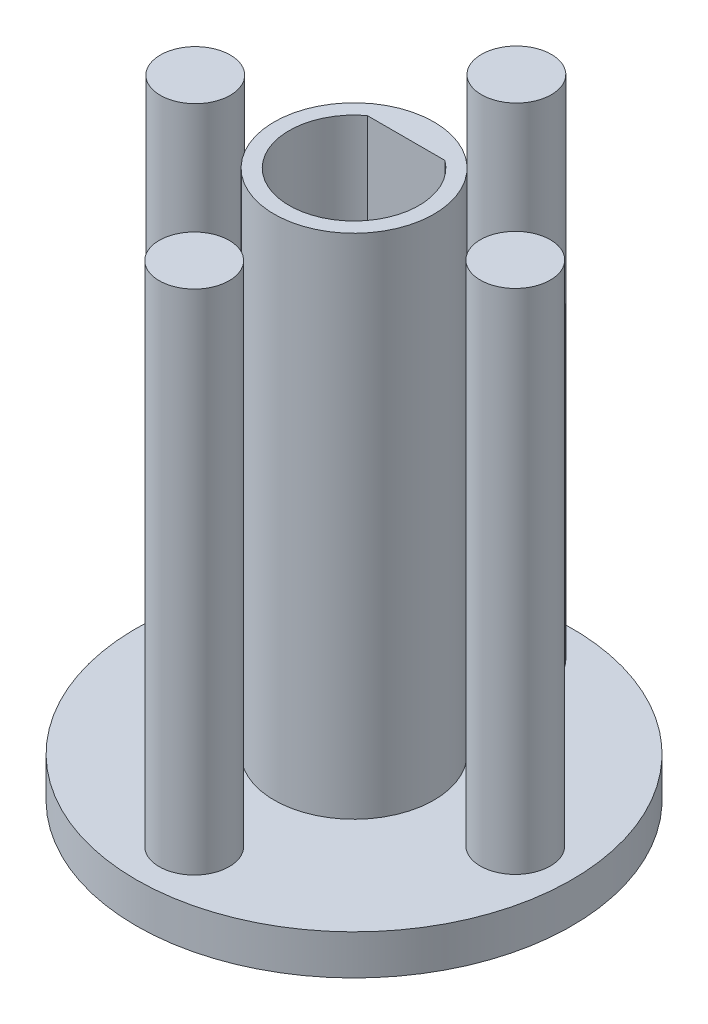
from build123d import *

# Parameters (mm, degrees)
SKETCH3_R             = 1.75
BOSS_EXTRUDE1_DEPTH   = 27.4
BOSS_EXTRUDE1_2_DEPTH = 27.4
BOSS_EXTRUDE1_3_DEPTH = 27.4
BOSS_EXTRUDE1_4_DEPTH = 27.4
SKETCH3_R_2           = 4
BOSS_EXTRUDE1_5_DEPTH = 27.4
SKETCH3_13_R          = 10.9
BOSS_EXTRUDE2_DEPTH   = 2


with BuildPart() as part:
    # Sketch3 → Boss-Extrude1 (new body)
    with BuildSketch(Plane(origin=(0, 0, 0), x_dir=(1, 0, 0), z_dir=(0, 1, 0))):
        with Locations((0.009034474, 8.115584077)):
            Circle(SKETCH3_R)
    extrude(amount=BOSS_EXTRUDE1_DEPTH)



with BuildPart() as body_2:
    # Sketch3 → Boss-Extrude1 2 (new body)
    with BuildSketch(Plane(origin=(0, 0, 0), x_dir=(1, 0, 0), z_dir=(0, 1, 0))):
        with Locations((8.017679827, 0.053335715)):
            Circle(SKETCH3_R)
    extrude(amount=BOSS_EXTRUDE1_2_DEPTH)


with BuildPart() as body_3:
    # Sketch3 → Boss-Extrude1 3 (new body)
    with BuildSketch(Plane(origin=(0, 0, 0), x_dir=(1, 0, 0), z_dir=(0, 1, 0))):
        with Locations((0.009179949, -8.009057152)):
            Circle(SKETCH3_R)
    extrude(amount=BOSS_EXTRUDE1_3_DEPTH)


with BuildPart() as body_4:
    # Sketch3 → Boss-Extrude1 4 (new body)
    with BuildSketch(Plane(origin=(0, 0, 0), x_dir=(1, 0, 0), z_dir=(0, 1, 0))):
        with Locations((-7.999465404, 0.05319121)):
            Circle(SKETCH3_R)
    extrude(amount=BOSS_EXTRUDE1_4_DEPTH)


with BuildPart() as body_5:
    # Sketch3 → Boss-Extrude1 5 (new body)
    with BuildSketch(Plane(origin=(0, 0, 0), x_dir=(1, 0, 0), z_dir=(0, 1, 0))):
        Circle(SKETCH3_R_2)
        with BuildLine():
            Line((-1.942645776, 2.605499451), (1.942645776, 2.605499451))
            ThreePointArc((1.942645776, 2.605499451), (0, -3.25), (-1.942645776, 2.605499451))
        make_face(mode=Mode.SUBTRACT)
    extrude(amount=BOSS_EXTRUDE1_5_DEPTH)


with BuildPart() as part_1:
    add(part.part)

    add(body_2.part)  # Boss-Extrude2 merges body 2

    add(body_3.part)  # Boss-Extrude2 merges body 3

    add(body_4.part)  # Boss-Extrude2 merges body 4

    add(body_5.part)  # Boss-Extrude2 merges body 5
    # Sketch3<13> → Boss-Extrude2 (add)
    with BuildSketch(Plane(origin=(0, 0, 0), x_dir=(1, 0, 0), z_dir=(0, 1, 0))):
        Circle(SKETCH3_13_R)
    extrude(amount=BOSS_EXTRUDE2_DEPTH)


solid = part_1.part
